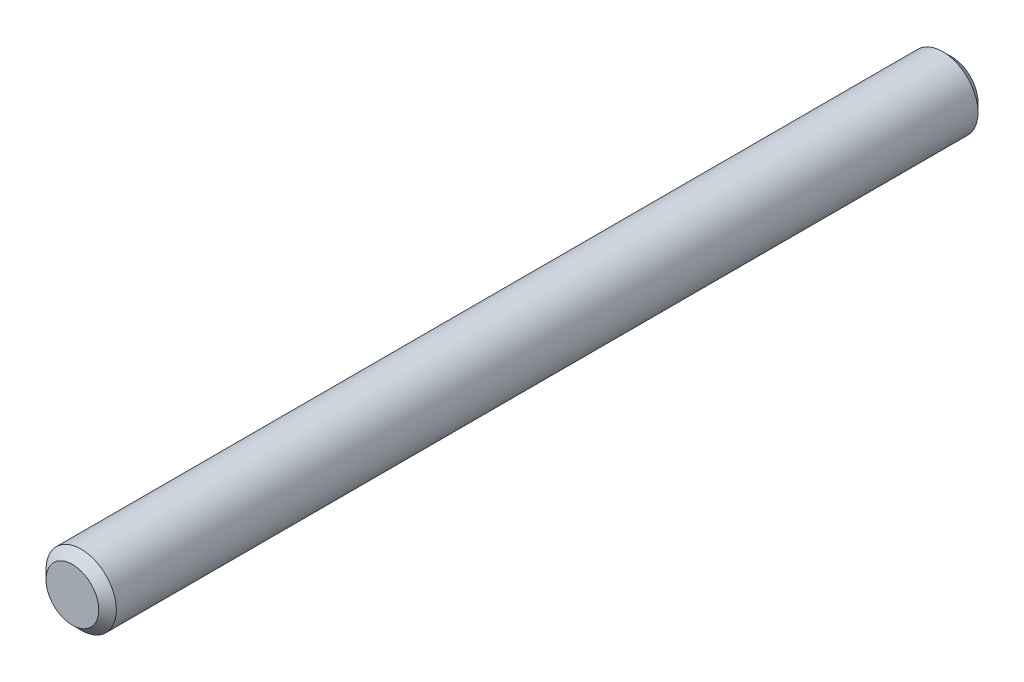
from build123d import *

# Parameters (mm, degrees)
SKETCH_1_R      = 2
EXTRUDE_1_DEPTH = 50
CHAMFER_1_SIZE  = 0.5


with BuildPart() as part:
    # 草图1 → 凸台-拉伸1 (new body)
    with BuildSketch(Plane.XY):
        Circle(SKETCH_1_R)
    extrude(amount=-EXTRUDE_1_DEPTH)

    # 倒角1
    chamfer_1_edges = [part.edges().sort_by_distance(p)[0] for p in [
        (-2, 0, 0),
        (-2, 0, -50),
    ]]
    chamfer(chamfer_1_edges, length=CHAMFER_1_SIZE)


solid = part.part
